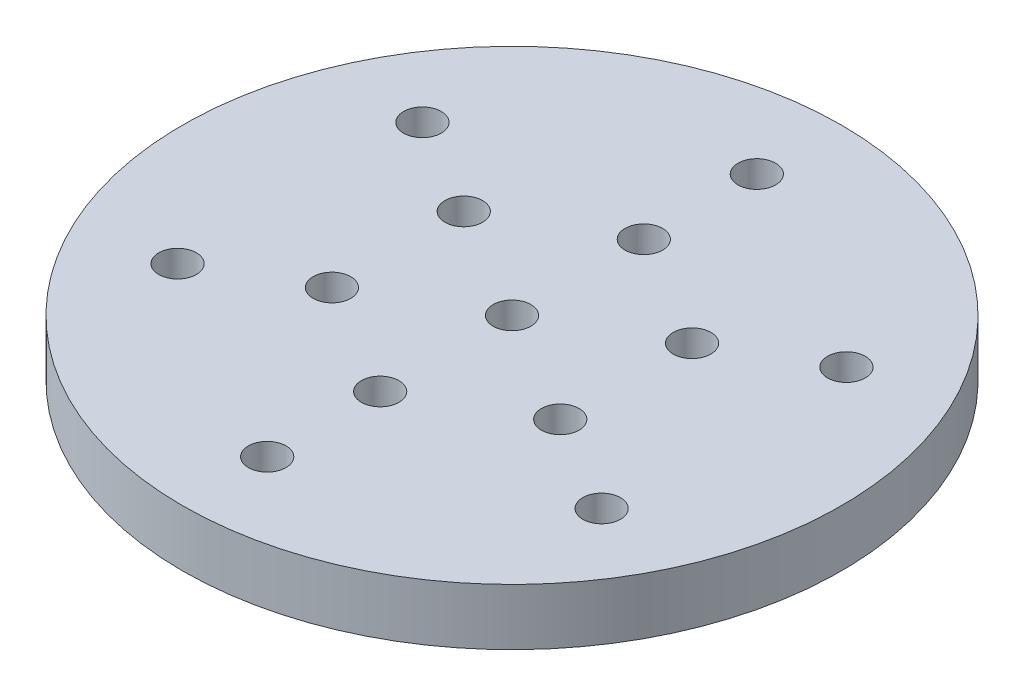
from build123d import *

# Parameters (mm, degrees)
SKETCH2_R           = 17.5
SKETCH2_R_2         = 1
BOSS_EXTRUDE1_DEPTH = 3


with BuildPart() as part:
    # Sketch2 → Boss-Extrude1 (new body)
    with BuildSketch(Plane(origin=(0, 0, 0), x_dir=(1, 0, 0), z_dir=(0, 1, 0))):
        with Locations(Location((0, 0, 0), (0, 0, 270))):
            Circle(SKETCH2_R)
        with Locations(Location((0, 13, 0), (0, 0, 270))):
            Circle(SKETCH2_R_2, mode=Mode.SUBTRACT)
        with Locations(Location((0, 7, 0), (0, 0, 270))):
            Circle(SKETCH2_R_2, mode=Mode.SUBTRACT)
        with Locations(Location((11.258330249, 6.5, 0), (0, 0, 270))):
            Circle(SKETCH2_R_2, mode=Mode.SUBTRACT)
        with Locations(Location((11.258330249, -6.5, 0), (0, 0, 270))):
            Circle(SKETCH2_R_2, mode=Mode.SUBTRACT)
        with Locations(Location((0, -13, 0), (0, 0, 270))):
            Circle(SKETCH2_R_2, mode=Mode.SUBTRACT)
        with Locations(Location((-11.258330249, -6.5, 0), (0, 0, 270))):
            Circle(SKETCH2_R_2, mode=Mode.SUBTRACT)
        with Locations(Location((-11.258330249, 6.5, 0), (0, 0, 270))):
            Circle(SKETCH2_R_2, mode=Mode.SUBTRACT)
        with Locations(Location((0, 0, 0), (0, 0, 270))):
            Circle(SKETCH2_R_2, mode=Mode.SUBTRACT)
        with Locations(Location((6.062177826, 3.5, 0), (0, 0, 270))):
            Circle(SKETCH2_R_2, mode=Mode.SUBTRACT)
        with Locations(Location((6.062177826, -3.5, 0), (0, 0, 270))):
            Circle(SKETCH2_R_2, mode=Mode.SUBTRACT)
        with Locations(Location((0, -7, 0), (0, 0, 270))):
            Circle(SKETCH2_R_2, mode=Mode.SUBTRACT)
        with Locations(Location((-6.062177826, -3.5, 0), (0, 0, 270))):
            Circle(SKETCH2_R_2, mode=Mode.SUBTRACT)
        with Locations(Location((-6.062177826, 3.5, 0), (0, 0, 270))):
            Circle(SKETCH2_R_2, mode=Mode.SUBTRACT)
    extrude(amount=BOSS_EXTRUDE1_DEPTH)


solid = part.part
